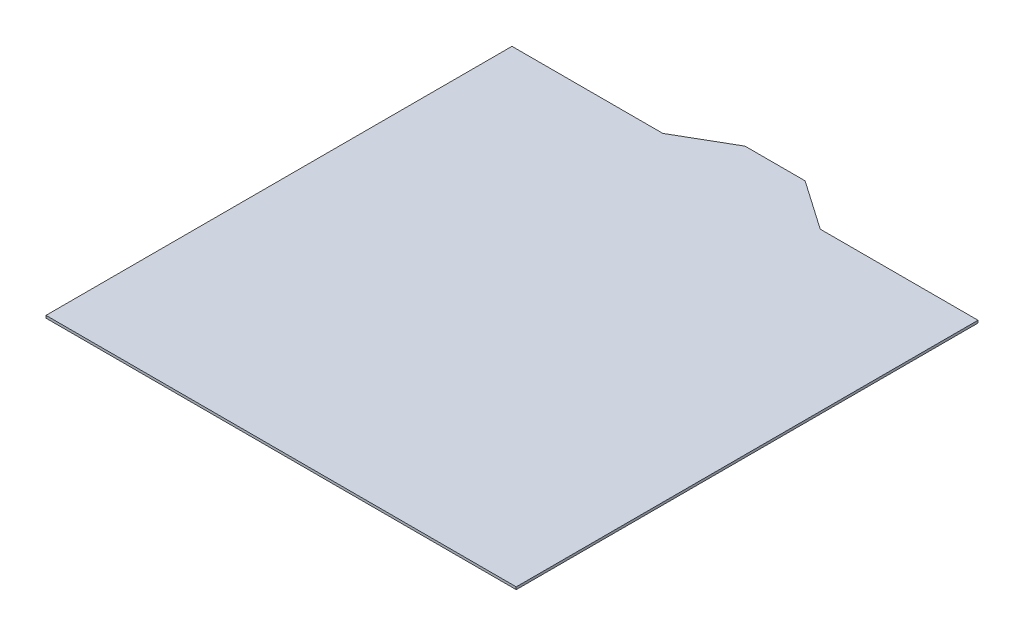
from build123d import *

# Parameters (mm, degrees)
BOSS_EXTRUDE1_DEPTH = 1.65


with BuildPart() as part:
    # Sketch1 → Boss-Extrude1 (new body)
    with BuildSketch(Plane(origin=(0, 0, 0), x_dir=(1, 0, 0), z_dir=(0, 1, 0))):
        Polygon((-22.127322024, 175.705878041), (17.872677976, 175.705878041), (50.731031807, 152.895166006), (155.702677976, 152.895166006), (155.702677976, -154.294121959), (-157.127322024, -154.294121959), (-157.127322024, 155.705878041), (-56.768338176, 155.705878041), align=None)
    extrude(amount=BOSS_EXTRUDE1_DEPTH)


solid = part.part
